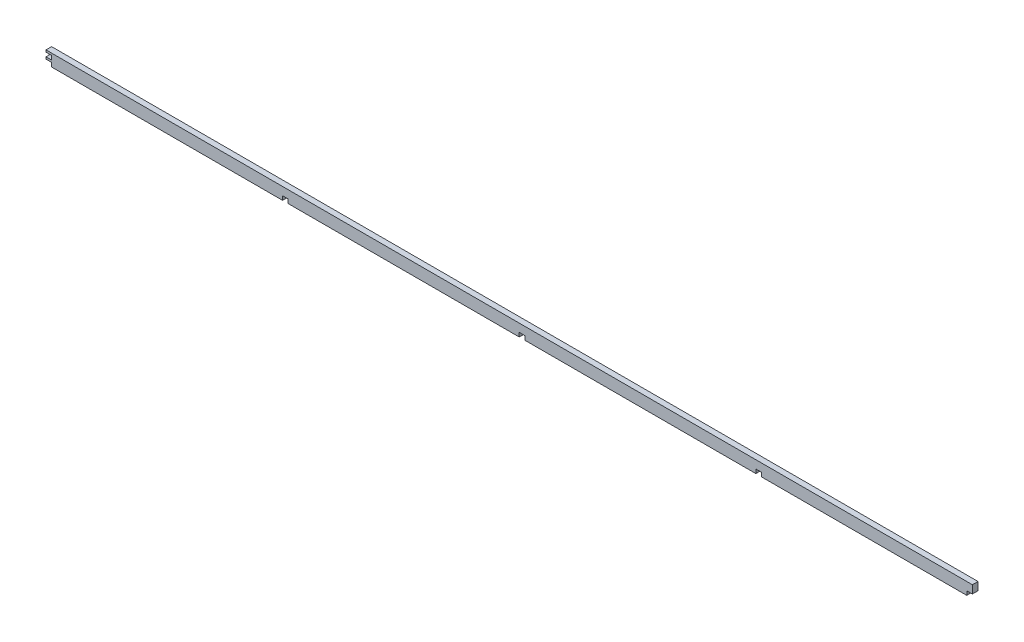
from build123d import *

# Parameters (mm, degrees)
EXTRUDE_1_DEPTH = 1.4


with BuildPart() as part:
    # Эскиз2 → Бобышка-Вытянуть1 (new, symmetric)
    with BuildSketch(Plane.XY):
        Polygon((-229.2, -3), (-114.2, -3), (-114.2, -1), (-111.4, -1), (-111.4, -3), (3.6, -3), (3.6, -1), (6.4, -1), (6.4, -3), (121.4, -3), (121.4, -1), (124.2, -1), (124.2, -3), (226.4, -3), (226.4, -1), (229.2, -1), (229.2, 3), (-229.2, 3), (-232, 3), (-232, 2), (-229.2, 2), (-229.2, 0), (-232, 0), (-232, -1), (-229.2, -1), align=None)
    extrude(amount=EXTRUDE_1_DEPTH, both=True)


solid = part.part
